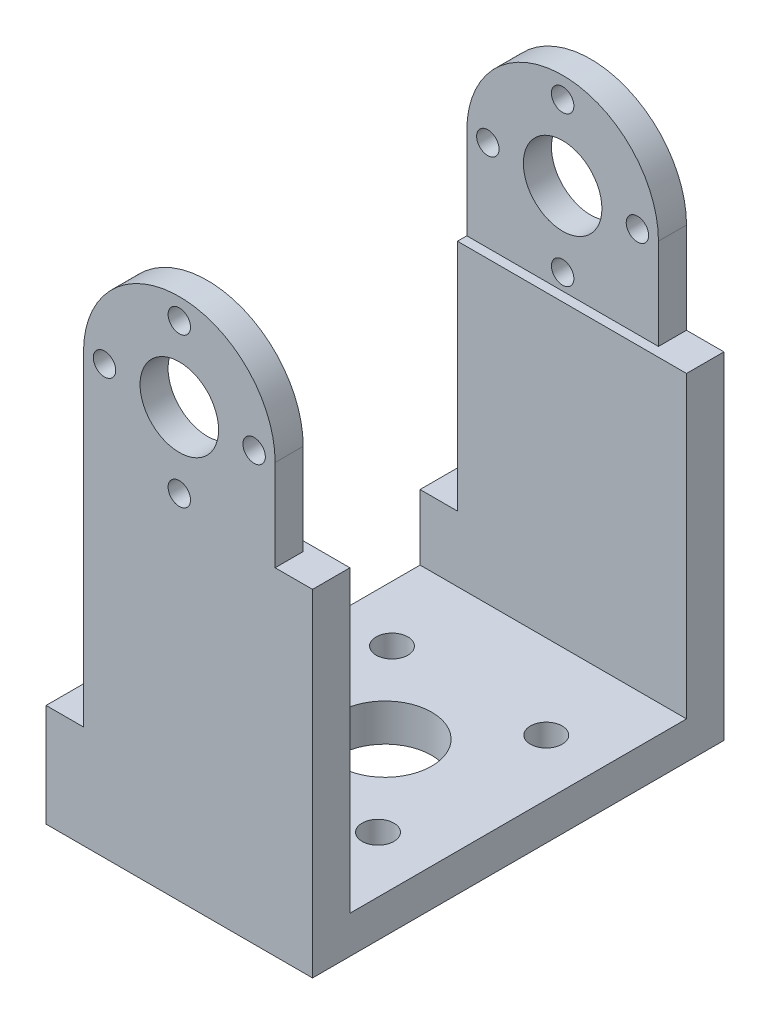
from build123d import *

# Parameters (mm, degrees)
BOSS_EXTRUDE1_DEPTH      = 22
BOSS_EXTRUDE1_DEPTH_BACK = 22
SKETCH1_R                = 1.2
SKETCH1_R_2              = 4.2
SKETCH2_W                = 38
SKETCH2_H                = 20
CUT_EXTRUDE1_DEPTH       = 105.423416914
SKETCH3_W                = 7
SKETCH3_H                = 44
BOSS_EXTRUDE2_DEPTH      = 36
SKETCH5_W                = 34
SKETCH5_H                = 50
CUT_EXTRUDE3_DEPTH       = 109.047443283
SKETCH6_W                = 20.5
SKETCH6_H                = 54.25
CUT_EXTRUDE4_DEPTH       = 111.605436123
SKETCH20_W               = 28.5
SKETCH20_H               = 34
SKETCH20_R               = 1.7
SKETCH20_R_2             = 5
BOSS_EXTRUDE5_DEPTH      = 4
SKETCH21_W               = 3
SKETCH21_H               = 36
CUT_EXTRUDE12_DEPTH      = 66.777085676
SKETCH22_W               = 4
SKETCH22_H               = 25
CUT_EXTRUDE14_DEPTH      = 66.054784605
CUT_EXTRUDE15_DEPTH      = 57.367654732
CUT_EXTRUDE15_DEPTH_BACK = 57.367654732
SKETCH23_W               = 36
SKETCH23_H               = 32


with BuildPart() as part:
    # Sketch1 → Boss-Extrude1 (new, two sides: drawn at the far end of the back side and taken through both)
    with BuildSketch(Plane.XY.offset(-BOSS_EXTRUDE1_DEPTH_BACK)):
        with BuildLine():
            ThreePointArc((10.25, 0), (0, 10.25), (-10.25, 0))
            Line((-10.25, 0), (-10.25, -100))
            Line((-10.25, -100), (10.25, -100))
            Line((10.25, -100), (10.25, 0))
        make_face()
        with Locations((8, 0)):
            Circle(SKETCH1_R, mode=Mode.SUBTRACT)
        with Locations((0, 8)):
            Circle(SKETCH1_R, mode=Mode.SUBTRACT)
        with Locations((-8, 0)):
            Circle(SKETCH1_R, mode=Mode.SUBTRACT)
        Circle(SKETCH1_R_2, mode=Mode.SUBTRACT)
        with Locations((0, -8)):
            Circle(SKETCH1_R, mode=Mode.SUBTRACT)
    extrude(amount=BOSS_EXTRUDE1_DEPTH + BOSS_EXTRUDE1_DEPTH_BACK)

    # Sketch2 → Cut-Extrude1 (cut, through all)
    with BuildSketch(Plane.ZY.offset(10.25)):
        with Locations((0, 0.25)):
            Rectangle(SKETCH2_W, SKETCH2_H)
    extrude(amount=-CUT_EXTRUDE1_DEPTH, mode=Mode.SUBTRACT)

    # Sketch3 → Boss-Extrude2 (add)
    with BuildSketch(Plane(origin=(0, -9.75, 0), x_dir=(1, 0, 0), z_dir=(0, 1, 0))):
        with Locations((-13.75, 0)):
            Rectangle(SKETCH3_W, SKETCH3_H)
        with Locations((13.75, 0)):
            Rectangle(SKETCH3_W, SKETCH3_H)
    extrude(amount=-BOSS_EXTRUDE2_DEPTH)

    # Sketch5 → Cut-Extrude3 (cut, through all)
    with BuildSketch(Plane.ZY.offset(17.25)):
        with Locations((0, -34.75)):
            Rectangle(SKETCH5_W, SKETCH5_H)
    extrude(amount=-CUT_EXTRUDE3_DEPTH, mode=Mode.SUBTRACT)

    # Sketch6 → Cut-Extrude4 (cut, through all)
    with BuildSketch(Plane.XY.offset(22)):
        with Locations((0, -72.875)):
            Rectangle(SKETCH6_W, SKETCH6_H)
    extrude(amount=-CUT_EXTRUDE4_DEPTH, mode=Mode.SUBTRACT)


with BuildPart() as cut_extrude4_piece_1:
    # of the separate pieces the step leaves, piece 1, a body of its own (cut_extrude4_pieces)
    add(part.part.solids().sort_by_distance((17.25, -45.75, -17))[0])



with BuildPart() as cut_extrude4_piece_2:
    # of the separate pieces the step leaves, piece 2, a body of its own (cut_extrude4_pieces)
    add(part.part.solids().sort_by_distance((-10.25, 0, 22))[0])


with BuildPart() as cut_extrude4_piece_1_1:
    add(cut_extrude4_piece_1.part)

    add(cut_extrude4_piece_2.part)  # Boss-Extrude5 merges Cut-Extrude4 piece 2
    # Sketch20 → Boss-Extrude5 (add)
    with BuildSketch(Plane.XZ.offset(45.75)):
        Rectangle(SKETCH20_W, SKETCH20_H)
        with Locations((-8.25, -9)):
            Circle(SKETCH20_R, mode=Mode.SUBTRACT)
        with Locations((8.25, -9)):
            Circle(SKETCH20_R, mode=Mode.SUBTRACT)
        with Locations((-8.25, 9)):
            Circle(SKETCH20_R, mode=Mode.SUBTRACT)
        Circle(SKETCH20_R_2, mode=Mode.SUBTRACT)
        with Locations((8.25, 9)):
            Circle(SKETCH20_R, mode=Mode.SUBTRACT)
    extrude(amount=-BOSS_EXTRUDE5_DEPTH)

    # Sketch21 → Cut-Extrude12 (cut, through all)
    with BuildSketch(Plane(origin=(0, 0, -22), x_dir=(-1, 0, 0), z_dir=(0, 0, -1))):
        with Locations((-15.75, -27.75)):
            Rectangle(SKETCH21_W, SKETCH21_H)
        with Locations((15.75, -27.75)):
            Rectangle(SKETCH21_W, SKETCH21_H)
    extrude(amount=-CUT_EXTRUDE12_DEPTH, mode=Mode.SUBTRACT)

    # Sketch22 → Cut-Extrude14 (cut, through all)
    with BuildSketch(Plane(origin=(0, 0, -22), x_dir=(-1, 0, 0), z_dir=(0, 0, -1))):
        with Locations((12.25, -22.25)):
            Rectangle(SKETCH22_W, SKETCH22_H)
    extrude(amount=-CUT_EXTRUDE14_DEPTH, mode=Mode.SUBTRACT)

    # Sketch23 → Cut-Extrude15 (cut, two sides: drawn at the far end of the back side and taken through both)
    with BuildSketch(Plane.ZY.offset(10.25).offset(-CUT_EXTRUDE15_DEPTH_BACK)):
        with Locations((0, -25.75)):
            Rectangle(SKETCH23_W, SKETCH23_H)
    extrude(amount=CUT_EXTRUDE15_DEPTH + CUT_EXTRUDE15_DEPTH_BACK, mode=Mode.SUBTRACT)


solid = cut_extrude4_piece_1_1.part
